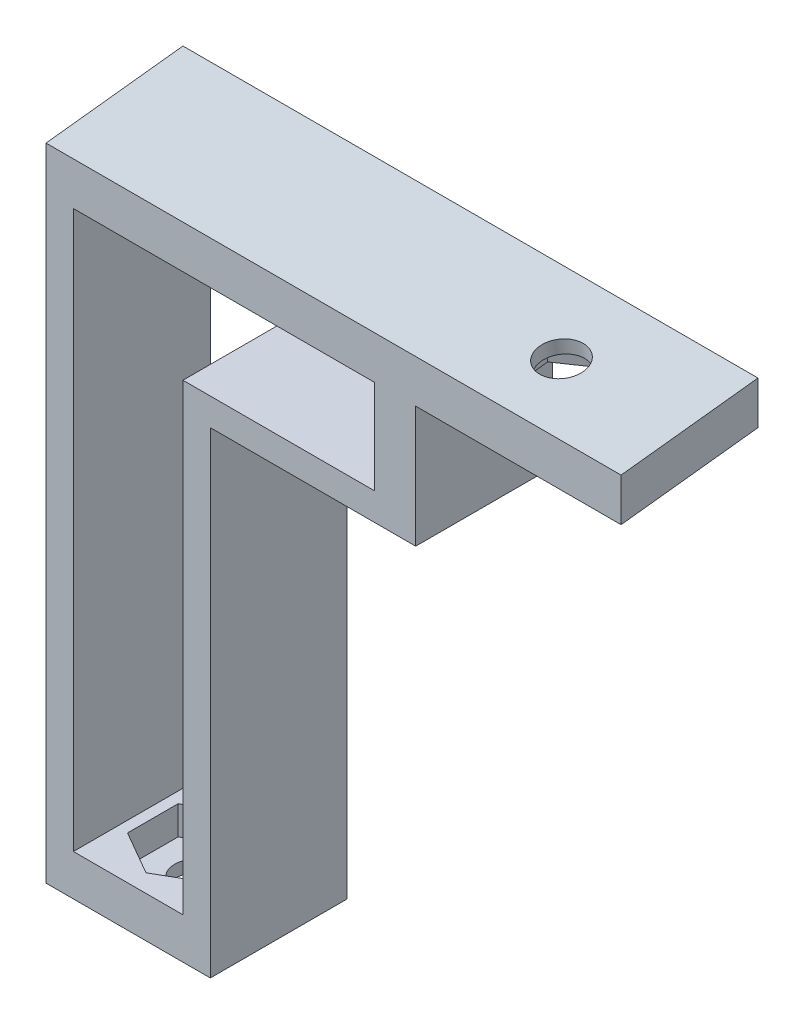
from build123d import *

# Parameters (mm, degrees)
BOSS_EXTRUDE1_DEPTH = 10
BOSS_EXTRUDE2_REACH = 65.68
SKETCH3_R           = 1.6
CUT_EXTRUDE1_DEPTH  = 2.1
SKETCH3_2_R         = 1.6
CUT_EXTRUDE2_DEPTH  = 55.597829326
SKETCH4_R           = 1.6
CUT_EXTRUDE3_DEPTH  = 2.1
SKETCH4_4_R         = 1.6
CUT_EXTRUDE4_DEPTH  = 55.958571782


with BuildPart() as part:
    # Sketch1 → Boss-Extrude1 (new body)
    with BuildSketch(Plane.XY):
        Polygon((-12, 0), (0, 0), (0, 34.81), (15, 34.81), (15, 44.81), (30, 44.81), (30, 46.81), (-12, 46.81), align=None)
        Polygon((12, 36.81), (-2, 36.81), (-2, 3), (-10, 3), (-10, 44.81), (12, 44.81), align=None, mode=Mode.SUBTRACT)
    extrude(amount=-BOSS_EXTRUDE1_DEPTH)

    # Boss-Extrude2: up to this face of the body (flat: up to its plane)
    boss_extrude2_end = Plane(part.part.faces().sort_by_distance((-12, 23.405, -5))[0])
    # Sketch2 → Boss-Extrude2 (add, up to the picked face)
    with BuildSketch(Plane(origin=(30, 0, 0), x_dir=(0, 0, -1), z_dir=(1, 0, 0)), mode=Mode.PRIVATE) as boss_extrude2_sk1:
        Polygon((10, 47.949356083), (0, 46.81), (10, 46.81), align=None)
    boss_extrude2_tool1 = split(extrude(boss_extrude2_sk1.sketch, amount=-BOSS_EXTRUDE2_REACH, mode=Mode.PRIVATE), bisect_by=boss_extrude2_end, keep=Keep.BOTH, mode=Mode.PRIVATE)
    # Sketch2 → Boss-Extrude2 (add, up to the picked face)
    with BuildSketch(Plane(origin=(30, 0, 0), x_dir=(0, 0, -1), z_dir=(1, 0, 0)), mode=Mode.PRIVATE) as boss_extrude2_sk2:
        Polygon((10, 44.81), (0, 44.81), (0, 43.670643917), align=None)
    boss_extrude2_tool2 = split(extrude(boss_extrude2_sk2.sketch, amount=-BOSS_EXTRUDE2_REACH, mode=Mode.PRIVATE), bisect_by=boss_extrude2_end, keep=Keep.BOTH, mode=Mode.PRIVATE)
    add(boss_extrude2_tool1.solids().sort_by(Axis((30, 47.189785, -6.666667), (-1, 0, 0)))[0])
    add(boss_extrude2_tool2.solids().sort_by(Axis((30, 44.430215, -3.333333), (-1, 0, 0)))[0])

    # Sketch3 → Cut-Extrude1 (cut)
    with BuildSketch(Plane(origin=(0, 43.11100603, 4.911878697), x_dir=(1, 0, 0), z_dir=(0, -0.9935718556765883, -0.11320321376790003))):
        Polygon((24.2, -8.128485041), (21, -6.280964179), (17.8, -8.128485041), (17.8, -11.823526764), (21, -13.671047625), (24.2, -11.823526764), align=None)
        with Locations(Location((21, -9.976005902, 0), (0, 0, 270))):
            Circle(SKETCH3_R, mode=Mode.SUBTRACT)
    extrude(amount=-CUT_EXTRUDE1_DEPTH, mode=Mode.SUBTRACT)

    # Sketch3<2> → Cut-Extrude2 (cut, through all)
    with BuildSketch(Plane(origin=(0, 43.11100603, 4.911878697), x_dir=(1, 0, 0), z_dir=(0, -0.9935718556765883, -0.11320321376790003))):
        with Locations(Location((21, -9.976005902, 0), (0, 0, 270))):
            Circle(SKETCH3_2_R)
    extrude(amount=-CUT_EXTRUDE2_DEPTH, mode=Mode.SUBTRACT)

    # Sketch4 → Cut-Extrude3 (cut)
    with BuildSketch(Plane(origin=(0, 3, 0), x_dir=(1, 0, 0), z_dir=(0, 1, 0))):
        Polygon((-2.8, 3.152479139), (-2.8, 6.847520861), (-6, 8.695041723), (-9.2, 6.847520861), (-9.2, 3.152479139), (-6, 1.304958277), align=None)
        with Locations(Location((-6, 5, 0), (0, 0, 270))):
            Circle(SKETCH4_R, mode=Mode.SUBTRACT)
    extrude(amount=-CUT_EXTRUDE3_DEPTH, mode=Mode.SUBTRACT)

    # Sketch4<4> → Cut-Extrude4 (cut, through all)
    with BuildSketch(Plane(origin=(0, 3, 0), x_dir=(1, 0, 0), z_dir=(0, 1, 0))):
        with Locations(Location((-6, 5, 0), (0, 0, 270))):
            Circle(SKETCH4_4_R)
    extrude(amount=-CUT_EXTRUDE4_DEPTH, mode=Mode.SUBTRACT)


solid = part.part
